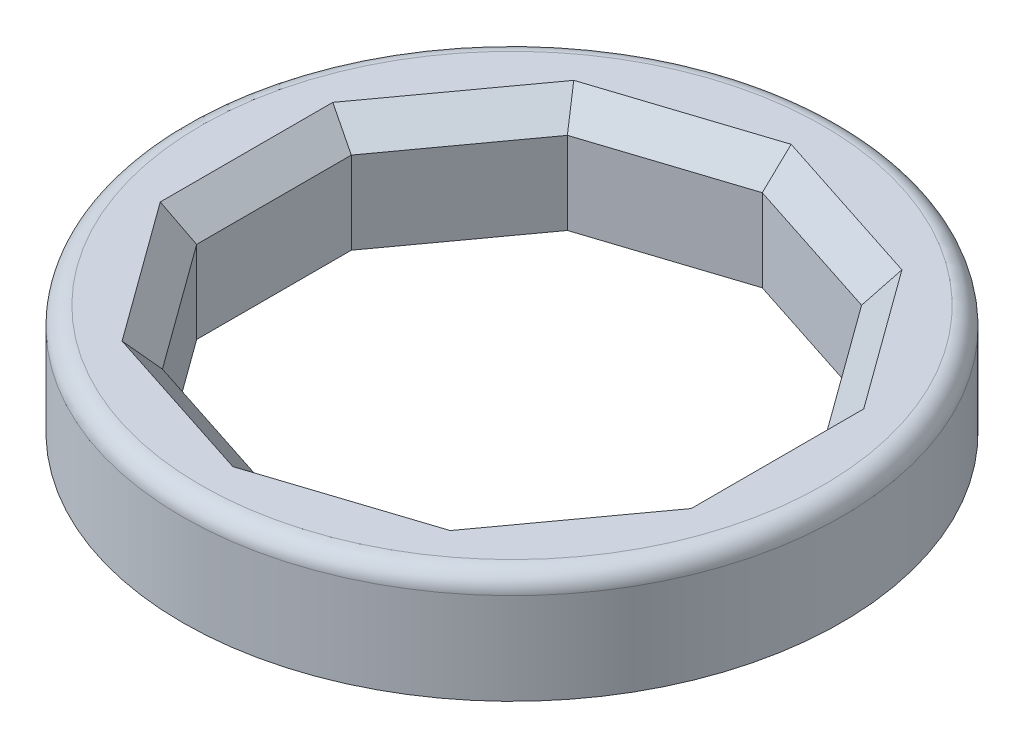
from build123d import *

# Parameters (mm, degrees)
SKETCH1_R           = 36
BOSS_EXTRUDE1_DEPTH = 12
FILLET1_R           = 2
CHAMFER1_SIZE       = 3


with BuildPart() as part:
    # Sketch1 → Boss-Extrude1 (new body)
    with BuildSketch(Plane(origin=(0, 0, 0), x_dir=(1, 0, 0), z_dir=(0, 1, 0))):
        with Locations(Location((0, 0, 0), (0, 0, 270))):
            Circle(SKETCH1_R)
        Polygon((16.068883707, 22.116921017), (0, 27.33801783), (-16.068883707, 22.116921017), (-26, 8.447912102), (-26, -8.447912102), (-16.068883707, -22.116921017), (0, -27.33801783), (16.068883707, -22.116921017), (26, -8.447912102), (26, 8.447912102), align=None, mode=Mode.SUBTRACT)
    extrude(amount=BOSS_EXTRUDE1_DEPTH)

    # Fillet1
    fillet1_edges = [part.edges().sort_by_distance(p)[0] for p in [
        (0, 12, -36),
    ]]
    fillet(fillet1_edges, radius=FILLET1_R)

    # Chamfer1
    chamfer1_edges = [part.edges().sort_by_distance(p)[0] for p in [
        (21.034441854, 12, -15.28241656),
        (8.034441854, 12, -24.727469424),
        (-8.034441854, 12, -24.727469424),
        (-21.034441854, 12, -15.28241656),
        (-26, 12, 0),
        (-21.034441854, 12, 15.28241656),
        (-8.034441854, 12, 24.727469424),
        (8.034441854, 12, 24.727469424),
        (21.034441854, 12, 15.28241656),
        (26, 12, 0),
    ]]
    chamfer(chamfer1_edges, length=CHAMFER1_SIZE)


solid = part.part
